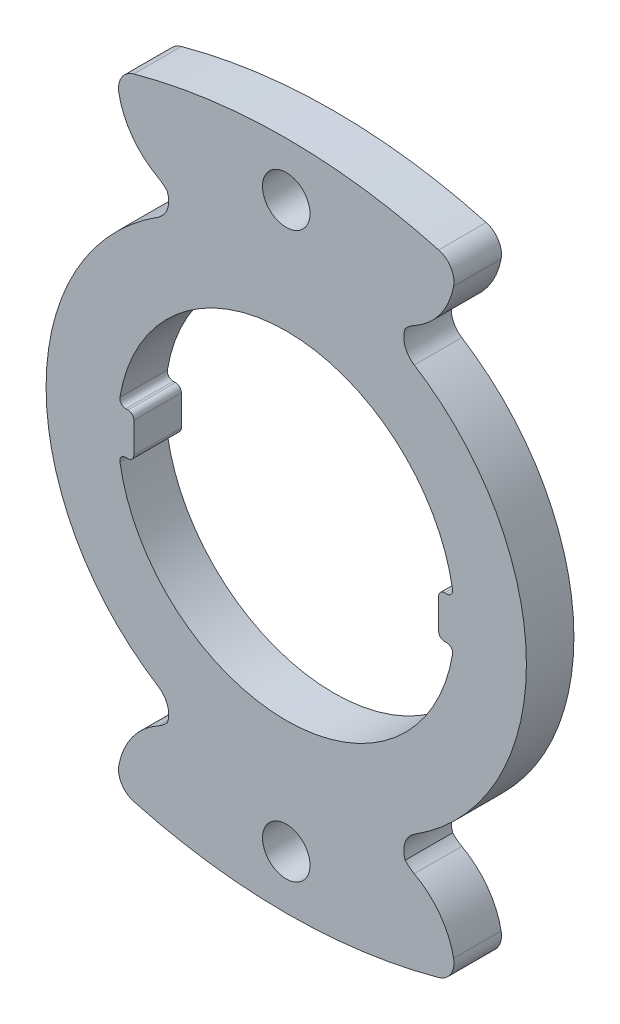
from build123d import *

# Parameters (mm, degrees)
BOSS_EXTRUDE2_DEPTH     = 4
FILLET1_R               = 0.5
FILLET2_R               = 0.5
CUT_EXTRUDE1_DEPTH      = 35.96700514
CUT_EXTRUDE1_DEPTH_BACK = 35.96700514
SKETCH4_R               = 2


with BuildPart() as part:
    # Sketch3 → Boss-Extrude2 (new body)
    with BuildSketch(Plane.XY):
        with BuildLine():
            ThreePointArc((-10.014736402, 19.376191891), (-9.990551511, 18.103554733), (-10.776995598, 17.102707121))
            ThreePointArc((-10.776995598, 17.102707121), (-20.215, 0), (-10.776995598, -17.102707121))
            ThreePointArc((-10.776995598, -17.102707121), (-9.990551511, -18.103554733), (-10.014736402, -19.376191891))
            ThreePointArc((-10.014736402, -19.376191891), (-10.36939918, -19.711941674), (-10.776995598, -19.98097469))
            ThreePointArc((-10.776995598, -19.98097469), (-12.938385888, -21.864089687), (-14.088666538, -24.48984377))
            ThreePointArc((-14.088666538, -24.48984377), (-13.85696402, -25.752415366), (-12.828666538, -26.520775556))
            ThreePointArc((-12.828666538, -26.520775556), (-6.472322707, -27.815519537), (0, -28.249694219))
            ThreePointArc((0, -28.249694219), (6.472322707, -27.815519537), (12.828666538, -26.520775556))
            ThreePointArc((12.828666538, -26.520775556), (13.85696402, -25.752415366), (14.088666538, -24.48984377))
            ThreePointArc((14.088666538, -24.48984377), (12.938385888, -21.864089687), (10.776995598, -19.98097469))
            ThreePointArc((10.776995598, -19.98097469), (10.36939918, -19.711941674), (10.014736402, -19.376191891))
            ThreePointArc((10.014736402, -19.376191891), (9.990551511, -18.103554733), (10.776995598, -17.102707121))
            ThreePointArc((10.776995598, -17.102707121), (20.215, 0), (10.776995598, 17.102707121))
            ThreePointArc((10.776995598, 17.102707121), (9.990551511, 18.103554733), (10.014736402, 19.376191891))
            ThreePointArc((10.014736402, 19.376191891), (10.36939918, 19.711941674), (10.776995598, 19.98097469))
            ThreePointArc((10.776995598, 19.98097469), (12.938385888, 21.864089687), (14.088666538, 24.48984377))
            ThreePointArc((14.088666538, 24.48984377), (13.85696402, 25.752415366), (12.828666538, 26.520775556))
            ThreePointArc((12.828666538, 26.520775556), (6.472322707, 27.815519537), (0, 28.249694219))
            ThreePointArc((0, 28.249694219), (-6.472322707, 27.815519537), (-12.828666538, 26.520775556))
            ThreePointArc((-12.828666538, 26.520775556), (-13.85696402, 25.752415366), (-14.088666538, 24.48984377))
            ThreePointArc((-14.088666538, 24.48984377), (-12.938385888, 21.864089687), (-10.776995598, 19.98097469))
            ThreePointArc((-10.776995598, 19.98097469), (-10.36939918, 19.711941674), (-10.014736402, 19.376191891))
        make_face()
        with BuildLine():
            Line((-12.828666538, -1.774676079), (-12.828666538, 1.774676079))
            Line((-12.828666538, 1.774676079), (-14.088666538, 1.774676079))
            ThreePointArc((-14.088666538, 1.774676079), (0, 14.2), (14.088666538, 1.774676079))
            Line((14.088666538, 1.774676079), (12.828666538, 1.774676079))
            Line((12.828666538, 1.774676079), (12.828666538, -1.774676079))
            Line((12.828666538, -1.774676079), (14.088666538, -1.774676079))
            ThreePointArc((14.088666538, -1.774676079), (0, -14.2), (-14.088666538, -1.774676079))
            Line((-14.088666538, -1.774676079), (-12.828666538, -1.774676079))
        make_face(mode=Mode.SUBTRACT)
    extrude(amount=BOSS_EXTRUDE2_DEPTH)

    # Fillet1
    fillet1_edges = [part.edges().sort_by_distance(p)[0] for p in [
        (-12.828666538, 1.774676079, 2),
        (-12.828666538, -1.774676079, 2),
        (12.828666538, -1.774676079, 2),
        (12.828666538, 1.774676079, 2),
    ]]
    fillet(fillet1_edges, radius=FILLET1_R)

    # Fillet2
    fillet2_edges = [part.edges().sort_by_distance(p)[0] for p in [
        (-14.088666538, 1.774676079, 2),
        (-14.088666538, -1.774676079, 2),
        (14.088666538, -1.774676079, 2),
        (14.088666538, 1.774676079, 2),
    ]]
    fillet(fillet2_edges, radius=FILLET2_R)

    # Sketch4 → Cut-Extrude1 (cut, two sides: drawn at the far end of the back side and taken through both)
    with BuildSketch(Plane.XY.offset(4).offset(-CUT_EXTRUDE1_DEPTH_BACK)):
        with Locations((0, 23.749694219)):
            Circle(SKETCH4_R)
        with Locations(Location((0, -23.749694219, 0), (0, 0, 180))):
            Circle(SKETCH4_R)
    extrude(amount=CUT_EXTRUDE1_DEPTH + CUT_EXTRUDE1_DEPTH_BACK, mode=Mode.SUBTRACT)


solid = part.part
